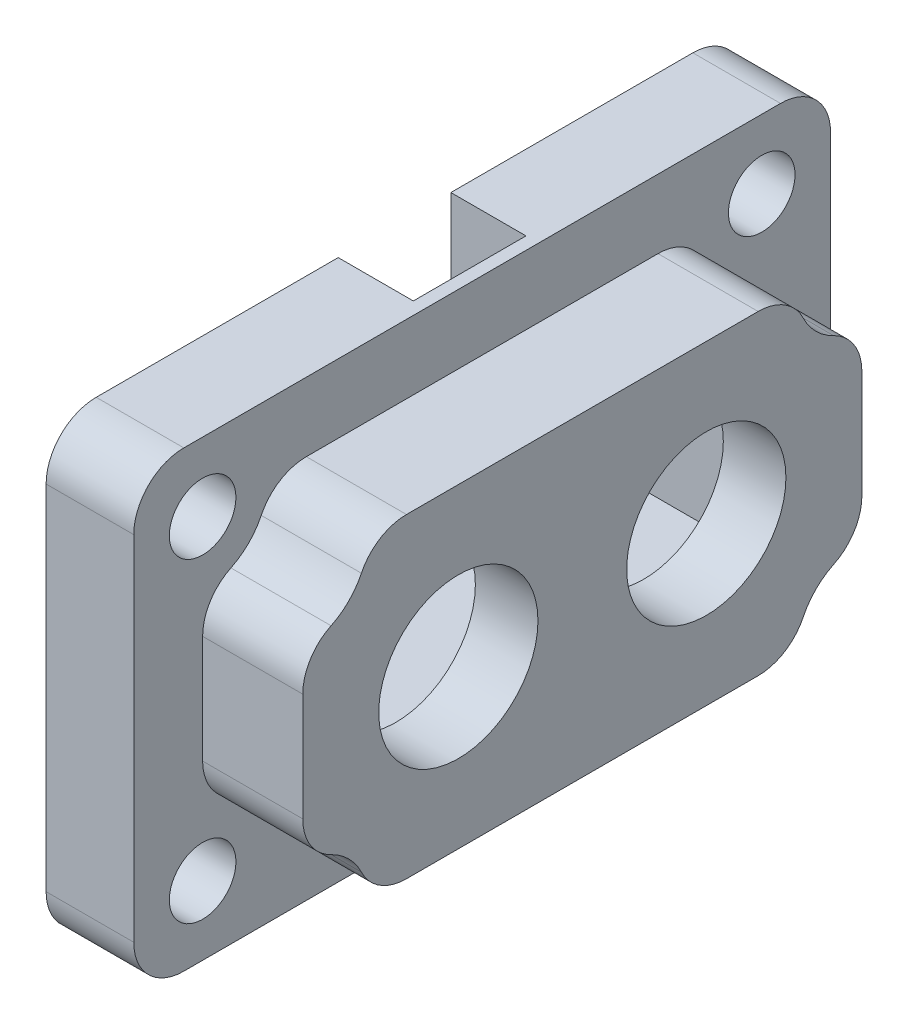
from build123d import *

# Parameters (mm, degrees)
SKETCH1_W           = 70.6882
SKETCH1_H           = 45.974
SKETCH1_R           = 8.0772
BOSS_EXTRUDE1_DEPTH = 6.35
SKETCH2_W           = 70.6882
SKETCH2_H           = 45.974
SKETCH2_W_2         = 45.4406
SKETCH2_H_2         = 20.7264
BOSS_EXTRUDE2_DEPTH = 12.7
SKETCH3_W           = 7.62
SKETCH3_H           = 11.43
CUT_EXTRUDE1_DEPTH  = 12.6238
SKETCH4_W           = 70.6882
SKETCH4_H           = 45.974
SKETCH4_R           = 3.3782
CUT_EXTRUDE2_DEPTH  = 10.16
SKETCH4_3_R         = 3.3782
CUT_EXTRUDE3_DEPTH  = 70.517572708
FILLET1_R           = 5.08


with BuildPart() as part:
    # Sketch1 → Boss-Extrude1 (new body)
    with BuildSketch(Plane(origin=(0, 0, 0), x_dir=(0, 0, -1), z_dir=(1, 0, 0))):
        with Locations((22.6441, 10.287)):
            Rectangle(SKETCH1_W, SKETCH1_H)
        with Locations((35.221300017, 10.287)):
            Circle(SKETCH1_R, mode=Mode.SUBTRACT)
        with Locations((10.066899983, 10.287)):
            Circle(SKETCH1_R, mode=Mode.SUBTRACT)
    extrude(amount=BOSS_EXTRUDE1_DEPTH)

    # Sketch2 → Boss-Extrude2 (add)
    with BuildSketch(Plane.ZY):
        with Locations((-22.6441, 10.287)):
            Rectangle(SKETCH2_W, SKETCH2_H)
        with Locations((-22.6441, 10.287)):
            Rectangle(SKETCH2_W_2, SKETCH2_H_2, mode=Mode.SUBTRACT)
    extrude(amount=BOSS_EXTRUDE2_DEPTH)

    # Sketch3 → Cut-Extrude1 (cut)
    with BuildSketch(Plane(origin=(0, 33.274, 0), x_dir=(1, 0, 0), z_dir=(0, 1, 0))):
        with Locations((-8.89, 22.6441)):
            Rectangle(SKETCH3_W, SKETCH3_H)
    extrude(amount=-CUT_EXTRUDE1_DEPTH, mode=Mode.SUBTRACT)

    # Sketch4 → Cut-Extrude2 (cut)
    # profile 1 of 5: a face of its own
    with BuildSketch(Plane(origin=(6.35, 0, 0), x_dir=(0, 0, -1), z_dir=(1, 0, 0))):
        with Locations((22.6441, 10.287)):
            Rectangle(SKETCH4_W, SKETCH4_H)
        with Locations((-5.715, 26.289)):
            Circle(SKETCH4_R, mode=Mode.SUBTRACT)
        with Locations((-5.715, -5.715)):
            Circle(SKETCH4_R, mode=Mode.SUBTRACT)
        with Locations((51.0032, -5.715)):
            Circle(SKETCH4_R, mode=Mode.SUBTRACT)
        with Locations((51.0032, 26.289)):
            Circle(SKETCH4_R, mode=Mode.SUBTRACT)
        with BuildLine():
            Line((-5.715, 19.685), (-5.715, 0.889))
            ThreePointArc((-5.715, 0.889), (-1.045266817, -1.045266817), (0.889, -5.715))
            Line((0.889, -5.715), (44.3992, -5.715))
            ThreePointArc((44.3992, -5.715), (46.333466817, -1.045266817), (51.0032, 0.889))
            Line((51.0032, 0.889), (51.0032, 19.685))
            ThreePointArc((51.0032, 19.685), (46.333466817, 21.619266817), (44.3992, 26.289))
            Line((44.3992, 26.289), (0.889, 26.289))
            ThreePointArc((0.889, 26.289), (-1.045266817, 21.619266817), (-5.715, 19.685))
        make_face(mode=Mode.SUBTRACT)
    # profile 2 of 5: a face of its own
    with BuildSketch(Plane(origin=(6.35, 0, 0), x_dir=(0, 0, -1), z_dir=(1, 0, 0))):
        with Locations((-5.715, -5.715)):
            Circle(SKETCH4_R)
    # profile 3 of 5: a face of its own
    with BuildSketch(Plane(origin=(6.35, 0, 0), x_dir=(0, 0, -1), z_dir=(1, 0, 0))):
        with Locations((-5.715, 26.289)):
            Circle(SKETCH4_R)
    # profile 4 of 5: a face of its own
    with BuildSketch(Plane(origin=(6.35, 0, 0), x_dir=(0, 0, -1), z_dir=(1, 0, 0))):
        with Locations((51.0032, 26.289)):
            Circle(SKETCH4_R)
    # profile 5 of 5: a face of its own
    with BuildSketch(Plane(origin=(6.35, 0, 0), x_dir=(0, 0, -1), z_dir=(1, 0, 0))):
        with Locations((51.0032, -5.715)):
            Circle(SKETCH4_R)
    extrude(amount=-CUT_EXTRUDE2_DEPTH, mode=Mode.SUBTRACT)

    # Sketch4<3> → Cut-Extrude3 (cut, through all)
    with BuildSketch(Plane(origin=(6.35, 0, 0), x_dir=(0, 0, -1), z_dir=(1, 0, 0))):
        with Locations((-5.715, -5.715)):
            Circle(SKETCH4_3_R)
        with Locations((-5.715, 26.289)):
            Circle(SKETCH4_3_R)
        with Locations((51.0032, 26.289)):
            Circle(SKETCH4_3_R)
        with Locations((51.0032, -5.715)):
            Circle(SKETCH4_3_R)
    extrude(amount=-CUT_EXTRUDE3_DEPTH, mode=Mode.SUBTRACT)

    # Fillet1
    fillet1_edges = [part.edges().sort_by_distance(p)[0] for p in [
        (-8.255, 33.274, 12.7),
        (-8.255, 33.274, -57.9882),
        (-8.255, -12.7, -57.9882),
        (-8.255, -12.7, 12.7),
        (1.27, 19.685, 5.715),
        (1.27, 0.889, 5.715),
        (1.27, -5.715, -0.889),
        (1.27, -5.715, -44.3992),
        (1.27, 0.889, -51.0032),
        (1.27, 19.685, -51.0032),
        (1.27, 26.289, -44.3992),
        (1.27, 26.289, -0.889),
    ]]
    fillet(fillet1_edges, radius=FILLET1_R)


solid = part.part
